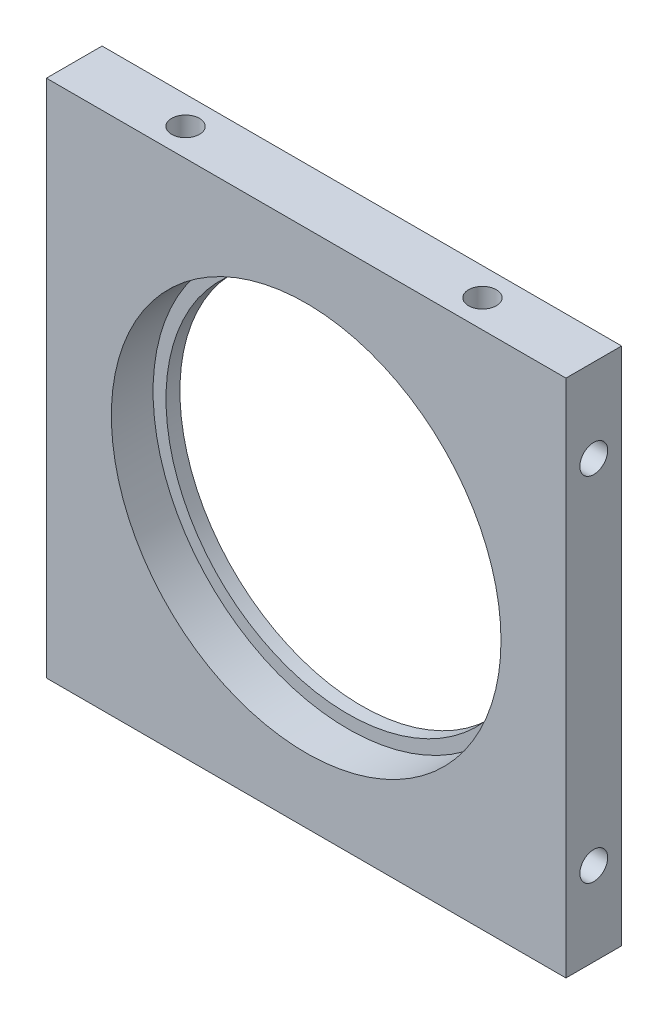
from build123d import *

# Parameters (mm, degrees)
SKETCH_2_W                     = 56
SKETCH_2_H                     = 56
EXTRUDE_1_DEPTH                = 3
M3X0_5_1_D                     = 2.5
M3X0_5_1_DEPTH                 = 8.5
M3X0_5_1_CBORE_D               = 3
M3X0_5_1_CBORE_DEPTH           = 6
M3X0_5_1_TIP                   = 0.751075774
M3X0_5_1_ON_FACE_2_D           = 2.5
M3X0_5_1_ON_FACE_2_DEPTH       = 8.5
M3X0_5_1_ON_FACE_2_CBORE_D     = 3
M3X0_5_1_ON_FACE_2_CBORE_DEPTH = 6
M3X0_5_1_ON_FACE_2_TIP         = 0.751075774
M3X0_5_1_ON_FACE_3_D           = 2.5
M3X0_5_1_ON_FACE_3_DEPTH       = 8.5
M3X0_5_1_ON_FACE_3_CBORE_D     = 3
M3X0_5_1_ON_FACE_3_CBORE_DEPTH = 6
M3X0_5_1_ON_FACE_3_TIP         = 0.751075774
M3X0_5_1_ON_FACE_4_D           = 2.5
M3X0_5_1_ON_FACE_4_DEPTH       = 8.5
M3X0_5_1_ON_FACE_4_CBORE_D     = 3
M3X0_5_1_ON_FACE_4_CBORE_DEPTH = 6
M3X0_5_1_ON_FACE_4_TIP         = 0.751075774


with BuildPart() as part:
    # ｽｹｯﾁ2 → ﾎﾞｽ - 押し出し1 (new, symmetric)
    with BuildSketch(Plane.XY):
        Rectangle(SKETCH_2_W, SKETCH_2_H)
    extrude(amount=EXTRUDE_1_DEPTH, both=True)

    # ｽｹｯﾁ3 → ｶｯﾄ - 回転1 (revolve, cut)
    with BuildSketch(Plane(origin=(0, 0, 0), x_dir=(0, 0, -1), z_dir=(1, 0, 0)), mode=Mode.PRIVATE) as cut_revolve_1_sk:
        Polygon((-3, 21), (1.5, 21), (1.5, 19.61), (3, 19.61), (3, 0), (-3, 0), align=None)
    revolve(cut_revolve_1_sk.sketch.rotate(Axis((0, 0, 0), (0, 0, -1)), 90), axis=Axis((0, 0, 0), (0, 0, -1)), mode=Mode.SUBTRACT)

    # M3x0.5 ねじ穴1
    with Locations(Plane(origin=(-16, 28, 0), x_dir=(1, 0, 0), z_dir=(0, 1, 0))):
        with Locations((0, 0), (32, 0)):
            CounterBoreHole(M3X0_5_1_D / 2, M3X0_5_1_CBORE_D / 2, M3X0_5_1_CBORE_DEPTH, depth=M3X0_5_1_DEPTH)
            with Locations((0, 0, -(M3X0_5_1_DEPTH + M3X0_5_1_TIP / 2))):  # 118° drill point
                Cone(0, M3X0_5_1_D / 2, M3X0_5_1_TIP, mode=Mode.SUBTRACT)

    # M3x0.5 ねじ穴1 on face 2
    with Locations(Plane(origin=(28, 19, 0), x_dir=(0, 0, 1), z_dir=(1, 0, 0))):
        with Locations((0, 0), (0, 38)):
            CounterBoreHole(M3X0_5_1_ON_FACE_2_D / 2, M3X0_5_1_ON_FACE_2_CBORE_D / 2, M3X0_5_1_ON_FACE_2_CBORE_DEPTH, depth=M3X0_5_1_ON_FACE_2_DEPTH)
            with Locations((0, 0, -(M3X0_5_1_ON_FACE_2_DEPTH + M3X0_5_1_ON_FACE_2_TIP / 2))):  # 118° drill point
                Cone(0, M3X0_5_1_ON_FACE_2_D / 2, M3X0_5_1_ON_FACE_2_TIP, mode=Mode.SUBTRACT)

    # M3x0.5 ねじ穴1 on face 3
    with Locations(Plane(origin=(16, -28, 0), x_dir=(0, 0, -1), z_dir=(0, -1, 0))):
        with Locations((0, 0), (0, -32)):
            CounterBoreHole(M3X0_5_1_ON_FACE_3_D / 2, M3X0_5_1_ON_FACE_3_CBORE_D / 2, M3X0_5_1_ON_FACE_3_CBORE_DEPTH, depth=M3X0_5_1_ON_FACE_3_DEPTH)
            with Locations((0, 0, -(M3X0_5_1_ON_FACE_3_DEPTH + M3X0_5_1_ON_FACE_3_TIP / 2))):  # 118° drill point
                Cone(0, M3X0_5_1_ON_FACE_3_D / 2, M3X0_5_1_ON_FACE_3_TIP, mode=Mode.SUBTRACT)

    # M3x0.5 ねじ穴1 on face 4
    with Locations(Plane(origin=(-28, 19, 0), x_dir=(0, 0, -1), z_dir=(-1, 0, 0))):
        with Locations((0, 0), (0, 38)):
            CounterBoreHole(M3X0_5_1_ON_FACE_4_D / 2, M3X0_5_1_ON_FACE_4_CBORE_D / 2, M3X0_5_1_ON_FACE_4_CBORE_DEPTH, depth=M3X0_5_1_ON_FACE_4_DEPTH)
            with Locations((0, 0, -(M3X0_5_1_ON_FACE_4_DEPTH + M3X0_5_1_ON_FACE_4_TIP / 2))):  # 118° drill point
                Cone(0, M3X0_5_1_ON_FACE_4_D / 2, M3X0_5_1_ON_FACE_4_TIP, mode=Mode.SUBTRACT)


solid = part.part
